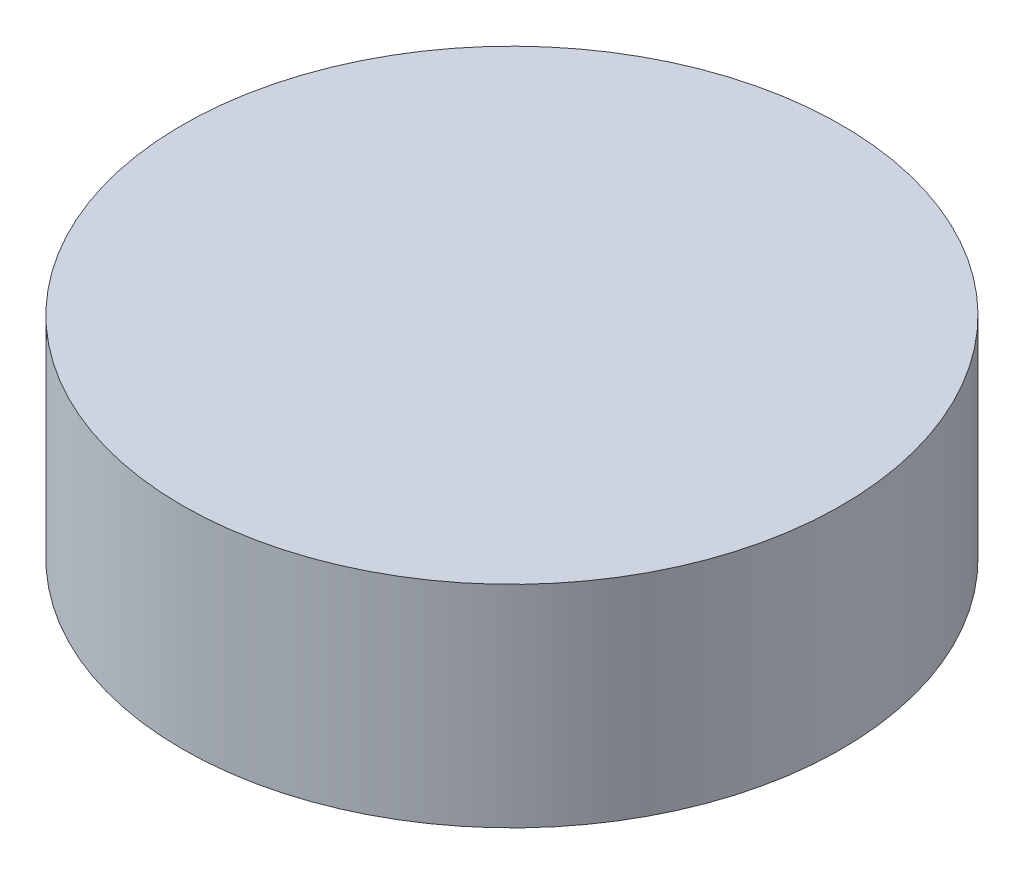
from build123d import *

# Parameters (mm, degrees)
ESQUISSE1_R        = 37.5
BOSS_EXTRU_1_DEPTH = 24


with BuildPart() as part:
    # Esquisse1 → Boss.-Extru.1 (new body)
    with BuildSketch(Plane(origin=(0, 0, 0), x_dir=(1, 0, 0), z_dir=(0, 1, 0))):
        with Locations(Location((0, 0, 0), (0, 0, 270))):
            Circle(ESQUISSE1_R)
    extrude(amount=BOSS_EXTRU_1_DEPTH)


solid = part.part
